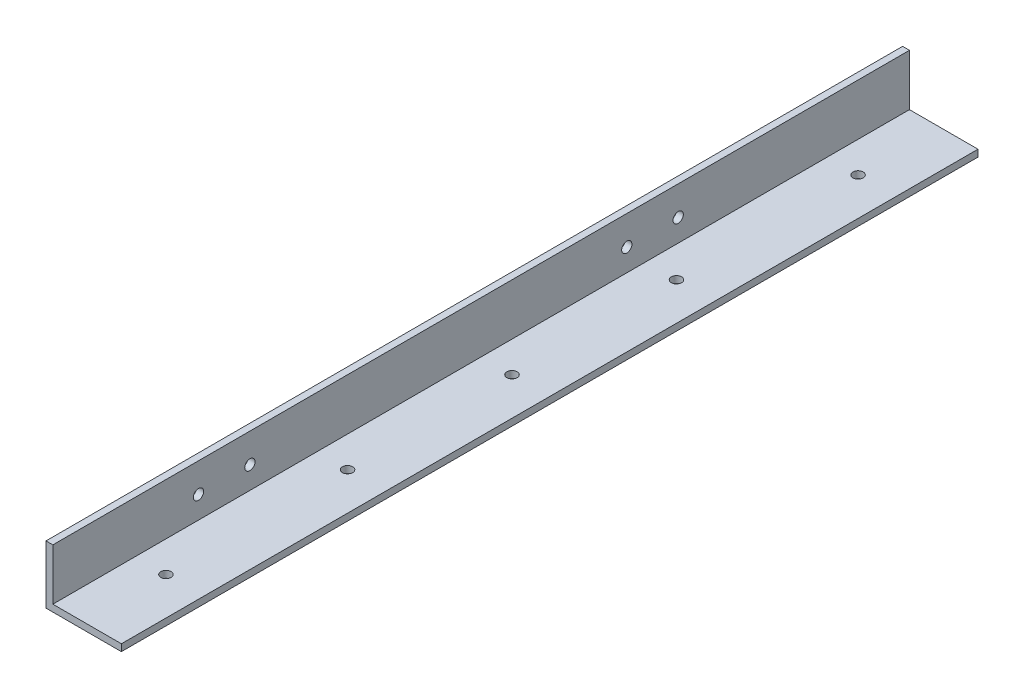
from build123d import *

# Parameters (mm, degrees)
BOSS_EXTRUDE1_DEPTH = 250
SKETCH2_R           = 1.5
CUT_EXTRUDE1_DEPTH  = 20
SKETCH3_R           = 1.5
CUT_EXTRUDE2_DEPTH  = 10


with BuildPart() as part:
    # Sketch1 → Boss-Extrude1 (new body)
    with BuildSketch(Plane.XY):
        Polygon((0, 0), (0, 17), (2, 17), (2, 2), (22, 2), (22, 0), align=None)
    extrude(amount=-BOSS_EXTRUDE1_DEPTH)

    # Sketch2 → Cut-Extrude1 (cut)
    with BuildSketch(Plane(origin=(0, 2, 0), x_dir=(1, 0, 0), z_dir=(0, 1, 0))):
        with Locations(Location((11, 226, 0), (0, 0, 270))):
            Circle(SKETCH2_R)
        with Locations(Location((11, 24, 0), (0, 0, 90))):
            Circle(SKETCH2_R)
        with Locations(Location((11, 125, 0), (0, 0, 270))):
            Circle(SKETCH2_R)
        with Locations(Location((11, 173, 0), (0, 0, 270))):
            Circle(SKETCH2_R)
        with Locations(Location((11, 77, 0), (0, 0, 270))):
            Circle(SKETCH2_R)
    extrude(amount=-CUT_EXTRUDE1_DEPTH, mode=Mode.SUBTRACT)

    # Sketch3 → Cut-Extrude2 (cut)
    with BuildSketch(Plane.ZY):
        with Locations((-182.5, 8.5)):
            Circle(SKETCH3_R)
        with Locations((-167.5, 8.5)):
            Circle(SKETCH3_R)
        with Locations((-42.5, 8.5)):
            Circle(SKETCH3_R)
        with Locations((-57.5, 8.5)):
            Circle(SKETCH3_R)
    extrude(amount=-CUT_EXTRUDE2_DEPTH, mode=Mode.SUBTRACT)


solid = part.part
